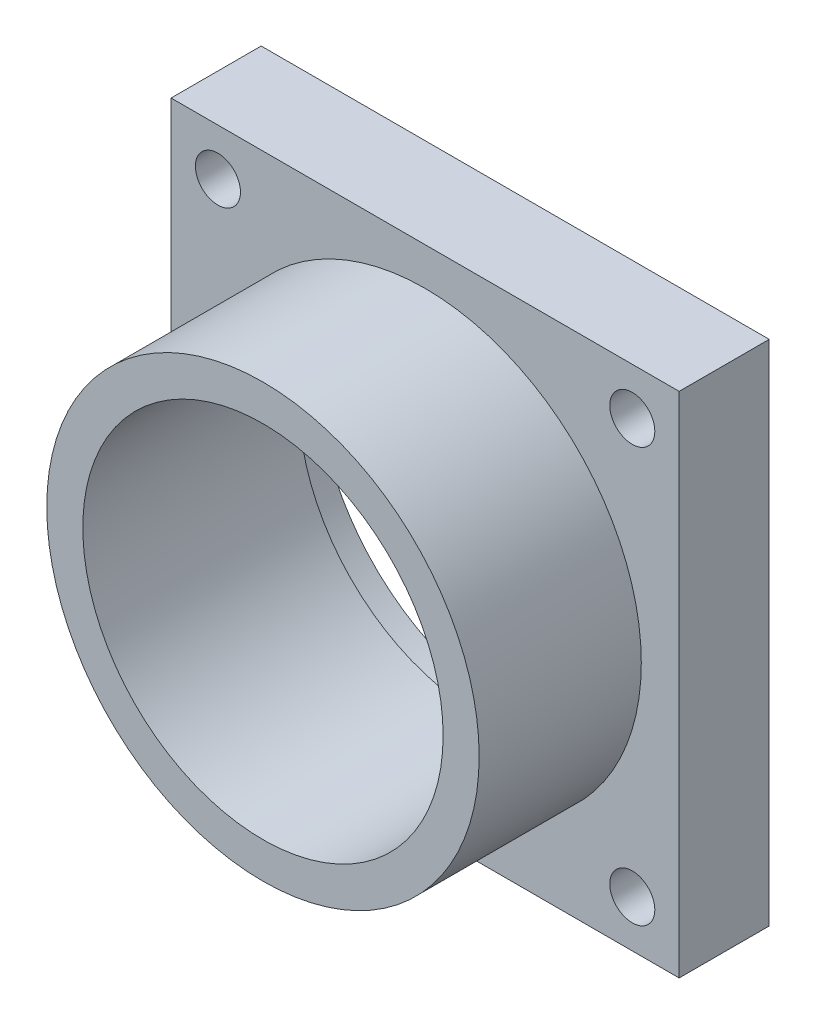
from build123d import *

# Parameters (mm, degrees)
SKETCH1_W           = 28.2
SKETCH1_H           = 28.2
SKETCH1_R           = 1.25
SKETCH1_R_2         = 10
BOSS_EXTRUDE1_DEPTH = 5
SKETCH1_3_R         = 12
SKETCH1_3_R_2       = 10
BOSS_EXTRUDE2_DEPTH = 14
SKETCH1_4_R         = 11
SKETCH1_4_R_2       = 10
CUT_EXTRUDE1_DEPTH  = 2


with BuildPart() as part:
    # Sketch1 → Boss-Extrude1 (new body)
    with BuildSketch(Plane.XY):
        Rectangle(SKETCH1_W, SKETCH1_H)
        with Locations((-11.5, -11.5)):
            Circle(SKETCH1_R, mode=Mode.SUBTRACT)
        with Locations((11.5, -11.5)):
            Circle(SKETCH1_R, mode=Mode.SUBTRACT)
        with Locations((-11.5, 11.5)):
            Circle(SKETCH1_R, mode=Mode.SUBTRACT)
        with Locations((11.5, 11.5)):
            Circle(SKETCH1_R, mode=Mode.SUBTRACT)
        Circle(SKETCH1_R_2, mode=Mode.SUBTRACT)
    extrude(amount=BOSS_EXTRUDE1_DEPTH)

    # Sketch1<3> → Boss-Extrude2 (add)
    with BuildSketch(Plane.XY):
        Circle(SKETCH1_3_R)
        Circle(SKETCH1_3_R_2, mode=Mode.SUBTRACT)
    extrude(amount=BOSS_EXTRUDE2_DEPTH)

    # Sketch1<4> → Cut-Extrude1 (cut)
    with BuildSketch(Plane.XY):
        Circle(SKETCH1_4_R)
        Circle(SKETCH1_4_R_2, mode=Mode.SUBTRACT)
    extrude(amount=CUT_EXTRUDE1_DEPTH, mode=Mode.SUBTRACT)


solid = part.part
